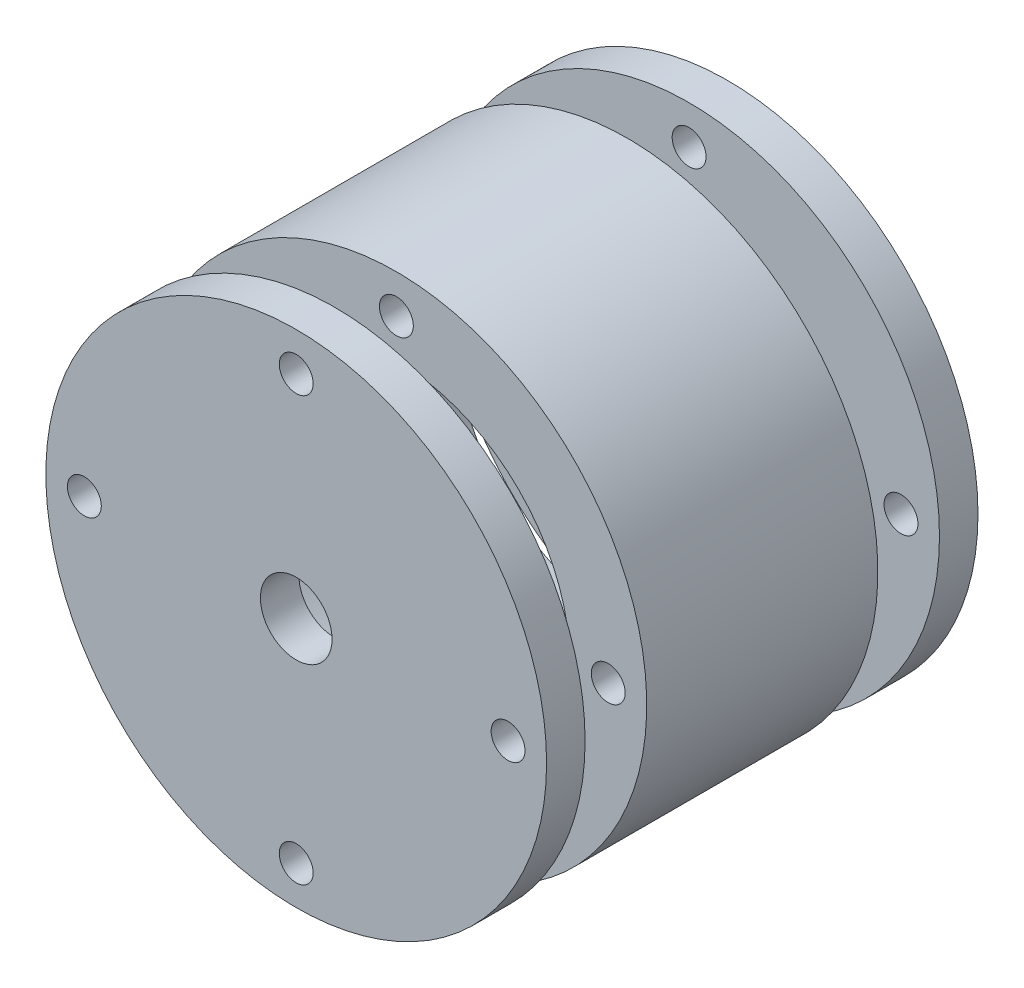
from build123d import *

# Parameters (mm, degrees)
SKETCH2_R               = 32.5
SKETCH2_R_2             = 2.2
SKETCH2_R_3             = 4.65
BOSS_EXTRUDE1_DEPTH     = 5
BOSS_EXTRUDE2_START     = 8
SKETCH3_R               = 32.5
SKETCH3_R_2             = 22.5
SKETCH3_R_3             = 2.2
BOSS_EXTRUDE2_DEPTH     = 30
CUT_EXTRUDE1_DEPTH      = 8
CUT_EXTRUDE1_DEPTH_BACK = 2.5
SKETCH4_R               = 20.6
SKETCH4_R_2             = 15.6
CUT_EXTRUDE2_START      = -2.5
SKETCH5_R               = 20.6
SKETCH5_R_2             = 15.6
CUT_EXTRUDE2_DEPTH      = 2.5


with BuildPart() as part:
    # Sketch2 → Boss-Extrude1 (new body)
    with BuildSketch(Plane.XY):
        with Locations((33.49662103, -33.754772237)):
            Circle(SKETCH2_R)
        with Locations((33.49662103, -6.254772237)):
            Circle(SKETCH2_R_2, mode=Mode.SUBTRACT)
        with Locations((5.99662103, -33.754772237)):
            Circle(SKETCH2_R_2, mode=Mode.SUBTRACT)
        with Locations((33.49662103, -61.254772237)):
            Circle(SKETCH2_R_2, mode=Mode.SUBTRACT)
        with Locations((60.99662103, -33.754772237)):
            Circle(SKETCH2_R_2, mode=Mode.SUBTRACT)
        with Locations((33.49662103, -33.754772237)):
            Circle(SKETCH2_R_3, mode=Mode.SUBTRACT)
    extrude(amount=BOSS_EXTRUDE1_DEPTH)


with BuildPart() as body_2:
    # Sketch3 → Boss-Extrude2 (new body)
    with BuildSketch(Plane(origin=(0, 0, 0), x_dir=(-1, 0, 0), z_dir=(0, 0, -1)).offset(BOSS_EXTRUDE2_START)):
        with Locations((-33.49662103, -33.754772237)):
            Circle(SKETCH3_R)
        with Locations((-33.49662103, -33.754772237)):
            Circle(SKETCH3_R_2, mode=Mode.SUBTRACT)
        with Locations((-33.49662103, -6.254772237)):
            Circle(SKETCH3_R_3, mode=Mode.SUBTRACT)
        with Locations((-5.99662103, -33.754772237)):
            Circle(SKETCH3_R_3, mode=Mode.SUBTRACT)
        with Locations((-33.49662103, -61.254772237)):
            Circle(SKETCH3_R_3, mode=Mode.SUBTRACT)
        with Locations((-60.99662103, -33.754772237)):
            Circle(SKETCH3_R_3, mode=Mode.SUBTRACT)
    extrude(amount=BOSS_EXTRUDE2_DEPTH)


with BuildPart() as body_3:
    # Mirror1: mirrored copy
    add(part.part.mirror(Plane(origin=(0, 0, -23), x_dir=(1, 0, 0), z_dir=(0, 0, -1))))

    # Sketch5 → Cut-Extrude2 (cut)
    with BuildSketch(Plane.XY.offset(-46).offset(CUT_EXTRUDE2_START)):
        with Locations((33.49662103, -33.754772237)):
            Circle(SKETCH5_R)
        with Locations((33.49662103, -33.754772237)):
            Circle(SKETCH5_R_2, mode=Mode.SUBTRACT)
    extrude(amount=CUT_EXTRUDE2_DEPTH, mode=Mode.SUBTRACT)


with BuildPart() as part_1:
    add(part.part)

    # Sketch4 → Cut-Extrude1 (cut, two sides: drawn at the far end of the back side and taken through both)
    with BuildSketch(Plane(origin=(0, 0, 0), x_dir=(-1, 0, 0), z_dir=(0, 0, -1)).offset(-CUT_EXTRUDE1_DEPTH_BACK)):
        with Locations(Location((-33.49662103, -33.754772237, 0), (0, 0, 180))):
            Circle(SKETCH4_R)
        with Locations(Location((-33.49662103, -33.754772237, 0), (0, 0, 180))):
            Circle(SKETCH4_R_2, mode=Mode.SUBTRACT)
    extrude(amount=CUT_EXTRUDE1_DEPTH + CUT_EXTRUDE1_DEPTH_BACK, mode=Mode.SUBTRACT)


solid = Compound([body_2.part, body_3.part, part_1.part])
